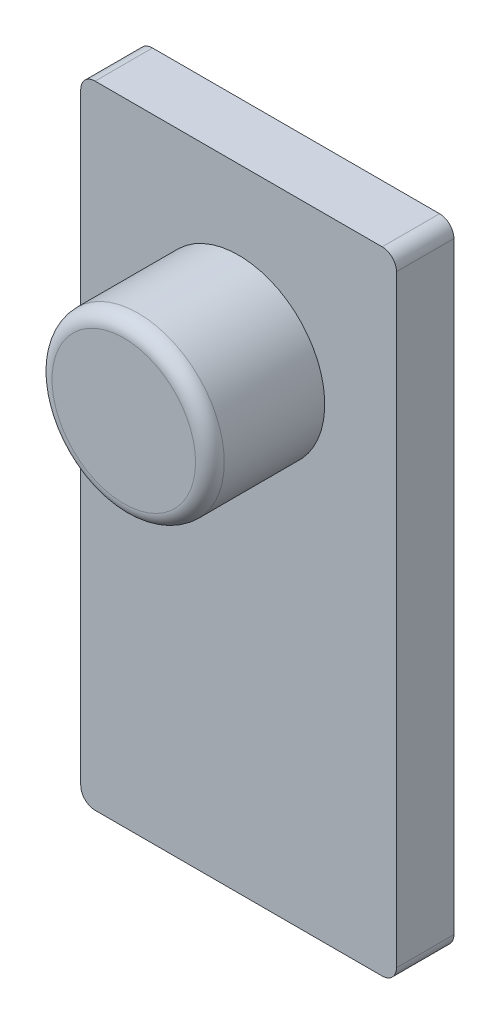
from build123d import *

# Parameters (mm, degrees)
SKETCH1_W           = 11
SKETCH1_H           = 22
BOSS_EXTRUDE1_DEPTH = 2
SKETCH2_R           = 3
BOSS_EXTRUDE2_DEPTH = 4
FILLET1_R           = 0.5


with BuildPart() as part:
    # Sketch1 → Boss-Extrude1 (new body)
    with BuildSketch(Plane.XY):
        with Locations((-6, 0)):
            Rectangle(SKETCH1_W, SKETCH1_H)
    extrude(amount=BOSS_EXTRUDE1_DEPTH)

    # Sketch2 → Boss-Extrude2 (add)
    with BuildSketch(Plane.XY.offset(2)):
        with Locations(Location((-6, 5.25, 0), (0, 0, 180))):
            Circle(SKETCH2_R)
    extrude(amount=BOSS_EXTRUDE2_DEPTH)

    # Fillet1
    fillet1_edges = [part.edges().sort_by_distance(p)[0] for p in [
        (-3, 5.25, 6),
        (-11.5, 11, 1),
        (-0.5, 11, 1),
        (-0.5, -11, 1),
        (-11.5, -11, 1),
    ]]
    fillet(fillet1_edges, radius=FILLET1_R)


solid = part.part
